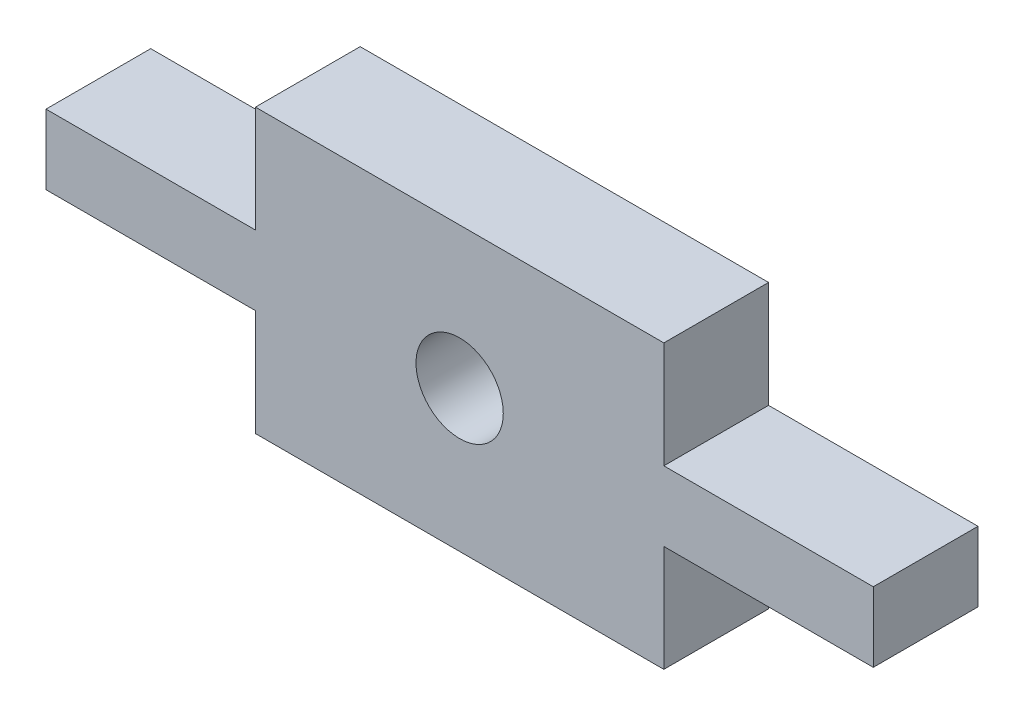
from build123d import *

# Parameters (mm, degrees)
SKETCH1_R           = 1.25
BOSS_EXTRUDE1_DEPTH = 3


with BuildPart() as part:
    # Sketch1 → Boss-Extrude1 (new body)
    with BuildSketch(Plane.XY):
        Polygon((-5.85, -1), (-5.85, -4.05), (5.85, -4.05), (5.85, -1), (11.85, -1), (11.85, 1), (5.85, 1), (5.85, 4.05), (-5.85, 4.05), (-5.85, 1), (-11.85, 1), (-11.85, -1), align=None)
        Circle(SKETCH1_R, mode=Mode.SUBTRACT)
    extrude(amount=BOSS_EXTRUDE1_DEPTH)


solid = part.part
